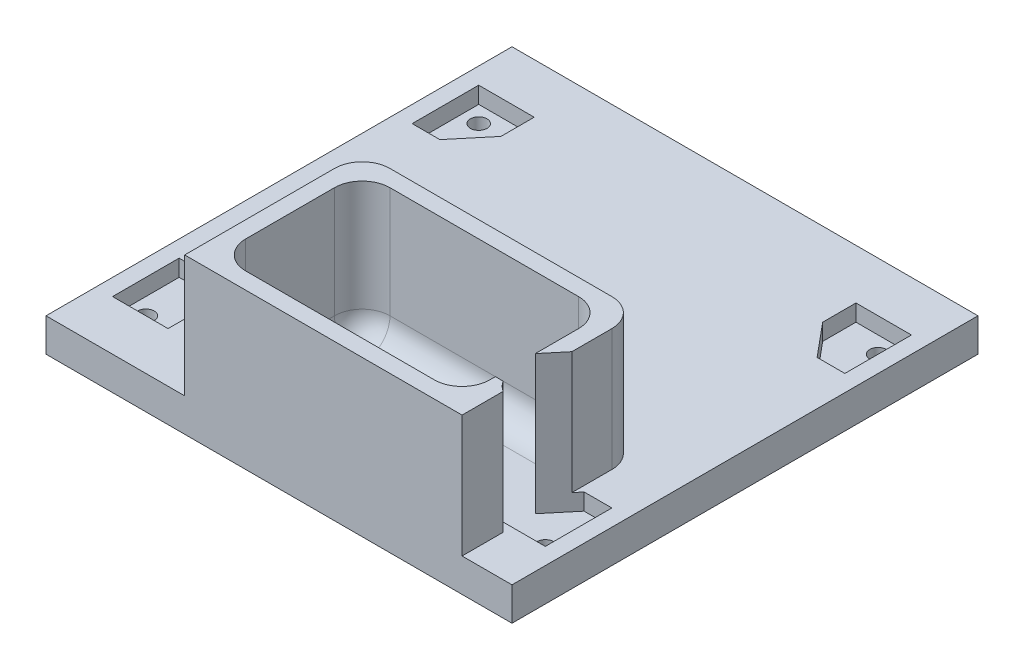
from build123d import *

# Parameters (mm, degrees)
SKETCH1_W               = 84
SKETCH1_H               = 84
BOSS_EXTRUDE1_DEPTH     = 6
SKETCH2_R               = 1.5
CUT_EXTRUDE1_DEPTH      = 119.94536561
SKETCH4_R               = 1.5
CUT_EXTRUDE4_DEPTH      = 3
MIRROR3_COPY_1_SKETCH_R = 1.5
MIRROR3_COPY_1_DEPTH    = 3
SKETCH5_W               = 50
SKETCH5_H               = 32
BOSS_EXTRUDE2_DEPTH     = 22
SKETCH6_W               = 44
SKETCH6_H               = 26
CUT_EXTRUDE5_DEPTH      = 25
SKETCH8_R               = 5.5
CUT_EXTRUDE14_DEPTH     = 22
CUT_EXTRUDE15_DEPTH     = 122.396046064
FILLET2_R               = 5
FILLET3_R               = 5


with BuildPart() as part:
    # Sketch1 → Boss-Extrude1 (new body)
    with BuildSketch(Plane(origin=(0, 0, 0), x_dir=(1, 0, 0), z_dir=(0, 1, 0))):
        with Locations((42, 42)):
            Rectangle(SKETCH1_W, SKETCH1_H)
    extrude(amount=BOSS_EXTRUDE1_DEPTH)

    # Sketch2 → Cut-Extrude1 (cut, through all)
    with BuildSketch(Plane(origin=(0, 6, 0), x_dir=(1, 0, 0), z_dir=(0, 1, 0))):
        with Locations(Location((6, 72, 0), (0, 0, 270))):
            Circle(SKETCH2_R)
        with Locations(Location((6, 12, 0), (0, 0, 270))):
            Circle(SKETCH2_R)
        with Locations(Location((78, 12, 0), (0, 0, 270))):
            Circle(SKETCH2_R)
        with Locations(Location((78, 72, 0), (0, 0, 270))):
            Circle(SKETCH2_R)
    extrude(amount=-CUT_EXTRUDE1_DEPTH, mode=Mode.SUBTRACT)

    # Sketch4 → Cut-Extrude4 (cut)
    with BuildSketch(Plane(origin=(0, 6, 0), x_dir=(1, 0, 0), z_dir=(0, 1, 0))):
        Polygon((13, 15), (13, 9), (3, 9), (3, 21), (8, 21), align=None)
        with Locations(Location((6, 12, 0), (0, 0, 270))):
            Circle(SKETCH4_R, mode=Mode.SUBTRACT)
    cut_extrude4 = extrude(amount=-CUT_EXTRUDE4_DEPTH, mode=Mode.SUBTRACT)

    # Mirror2: Cut-Extrude4 across plane
    add(cut_extrude4.mirror(Plane.XY.offset(-42)), mode=Mode.SUBTRACT)

    # Mirror3: Cut-Extrude4 across plane
    add(cut_extrude4.mirror(Plane.ZY.offset(-42)), mode=Mode.SUBTRACT)

    # Mirror3 copy 1 sketch → Mirror3 copy 1 (cut)
    with BuildSketch(Plane(origin=(84, 6, -84), x_dir=(-1, 0, 0), z_dir=(0, 1, 0))):
        Polygon((13, 15), (13, 9), (3, 9), (3, 21), (8, 21), align=None)
        with Locations(Location((6, 12, 0), (0, 0, 270))):
            Circle(MIRROR3_COPY_1_SKETCH_R, mode=Mode.SUBTRACT)
    extrude(amount=-MIRROR3_COPY_1_DEPTH, mode=Mode.SUBTRACT)

    # Sketch5 → Boss-Extrude2 (add)
    with BuildSketch(Plane(origin=(0, 6, 0), x_dir=(1, 0, 0), z_dir=(0, 1, 0))):
        with Locations((50, 16)):
            Rectangle(SKETCH5_W, SKETCH5_H)
    extrude(amount=BOSS_EXTRUDE2_DEPTH)

    # Sketch6 → Cut-Extrude5 (cut)
    with BuildSketch(Plane(origin=(0, 28, 0), x_dir=(1, 0, 0), z_dir=(0, 1, 0))):
        with Locations((50, 16)):
            Rectangle(SKETCH6_W, SKETCH6_H)
    extrude(amount=-CUT_EXTRUDE5_DEPTH, mode=Mode.SUBTRACT)

    # Sketch8 → Cut-Extrude14 (cut)
    with BuildSketch(Plane(origin=(0, 28, 0), x_dir=(1, 0, 0), z_dir=(0, 1, 0))):
        with Locations((78, 12)):
            Circle(SKETCH8_R)
    extrude(amount=-CUT_EXTRUDE14_DEPTH, mode=Mode.SUBTRACT)

    # Sketch13 → Cut-Extrude15 (cut, through all)
    with BuildSketch(Plane(origin=(0, 3, 0), x_dir=(1, 0, 0), z_dir=(0, 1, 0))):
        Polygon((72, 9), (81, 9), (81, 21), (76, 21), (72, 16.2), (72, 29), (28, 29), (28, 3), (72, 3), align=None)
    extrude(amount=CUT_EXTRUDE15_DEPTH, mode=Mode.SUBTRACT)

    # Fillet2
    fillet2_edges = [part.edges().sort_by_distance(p)[0] for p in [
        (75, 17, -32),
        (25, 17, -32),
    ]]
    fillet(fillet2_edges, radius=FILLET2_R)

    # Fillet3
    fillet3_edges = [part.edges().sort_by_distance(p)[0] for p in [
        (72, 15.5, -29),
        (72, 3, -6),
        (50, 3, -3),
        (72, 15.5, -3),
        (28, 3, -16),
        (28, 15.5, -3),
        (50, 3, -29),
        (28, 15.5, -29),
    ]]
    fillet(fillet3_edges, radius=FILLET3_R)


solid = part.part
